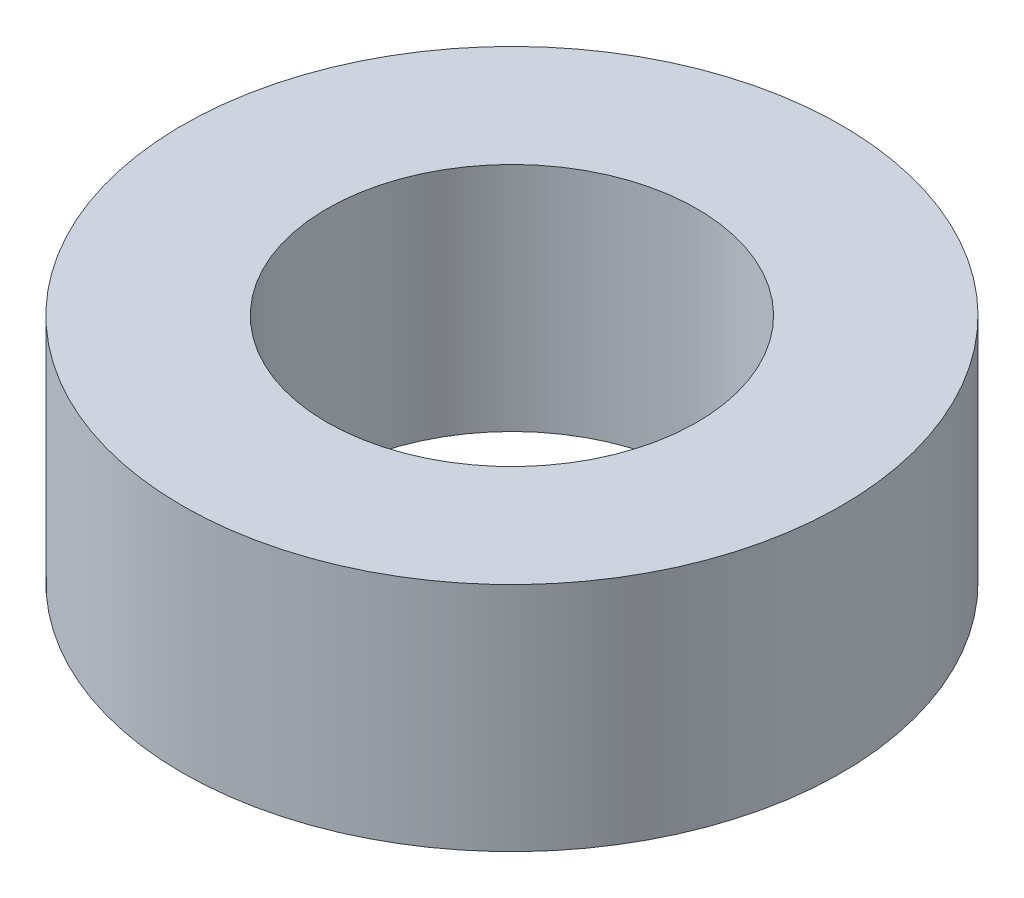
from build123d import *

# Parameters (mm, degrees)
SKETCH1_R           = 28.5
SKETCH1_R_2         = 16
BOSS_EXTRUDE1_DEPTH = 10


with BuildPart() as part:
    # Sketch1 → Boss-Extrude1 (new, symmetric)
    with BuildSketch(Plane(origin=(0, 0, 0), x_dir=(1, 0, 0), z_dir=(0, 1, 0))):
        with Locations(Location((0, 0, 0), (0, 0, 270))):
            Circle(SKETCH1_R)
        with Locations(Location((0, 0, 0), (0, 0, 270))):
            Circle(SKETCH1_R_2, mode=Mode.SUBTRACT)
    extrude(amount=BOSS_EXTRUDE1_DEPTH, both=True)


solid = part.part
